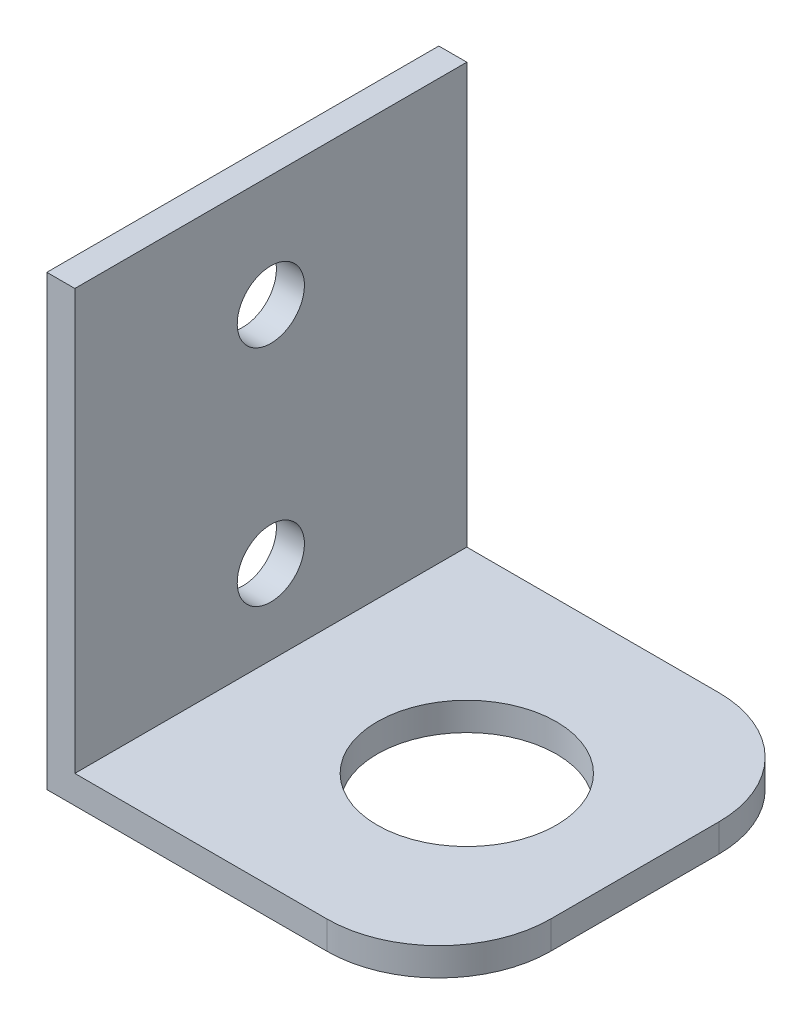
from build123d import *

# Parameters (mm, degrees)
BOSS_EXTRU_1_DEPTH      = 35
ESQUISSE2_R             = 8
ENL_V_MAT_EXTRU_1_DEPTH = 20
ESQUISSE3_R             = 3
ENL_V_MAT_EXTRU_2_DEPTH = 20
CONG_1_R                = 10


with BuildPart() as part:
    # Esquisse1 → Boss.-Extru.1 (new body)
    with BuildSketch(Plane.XY):
        Polygon((0, 0), (0, -37.5), (32.5, -37.5), (32.5, -40), (-2.5, -40), (-2.5, 0), align=None)
    extrude(amount=BOSS_EXTRU_1_DEPTH)

    # Esquisse2 → Enlèv. mat.-Extru.1 (cut)
    with BuildSketch(Plane(origin=(0, -40, 0), x_dir=(-1, 0, 0), z_dir=(0, -1, 0))):
        with Locations(Location((-17.5, -17.5, 0), (0, 0, 180))):
            Circle(ESQUISSE2_R)
    extrude(amount=-ENL_V_MAT_EXTRU_1_DEPTH, mode=Mode.SUBTRACT)

    # Esquisse3 → Enlèv. mat.-Extru.2 (cut)
    with BuildSketch(Plane(origin=(0, 0, 0), x_dir=(0, 0, -1), z_dir=(1, 0, 0))):
        with Locations(Location((-17.5, -10, 0), (0, 0, 90))):
            Circle(ESQUISSE3_R)
        with Locations(Location((-17.5, -30, 0), (0, 0, 90))):
            Circle(ESQUISSE3_R)
    extrude(amount=-ENL_V_MAT_EXTRU_2_DEPTH, mode=Mode.SUBTRACT)

    # Congé1
    cong_1_edges = [part.edges().sort_by_distance(p)[0] for p in [
        (32.5, -38.75, 35),
        (32.5, -38.75, 0),
    ]]
    fillet(cong_1_edges, radius=CONG_1_R)


solid = part.part
